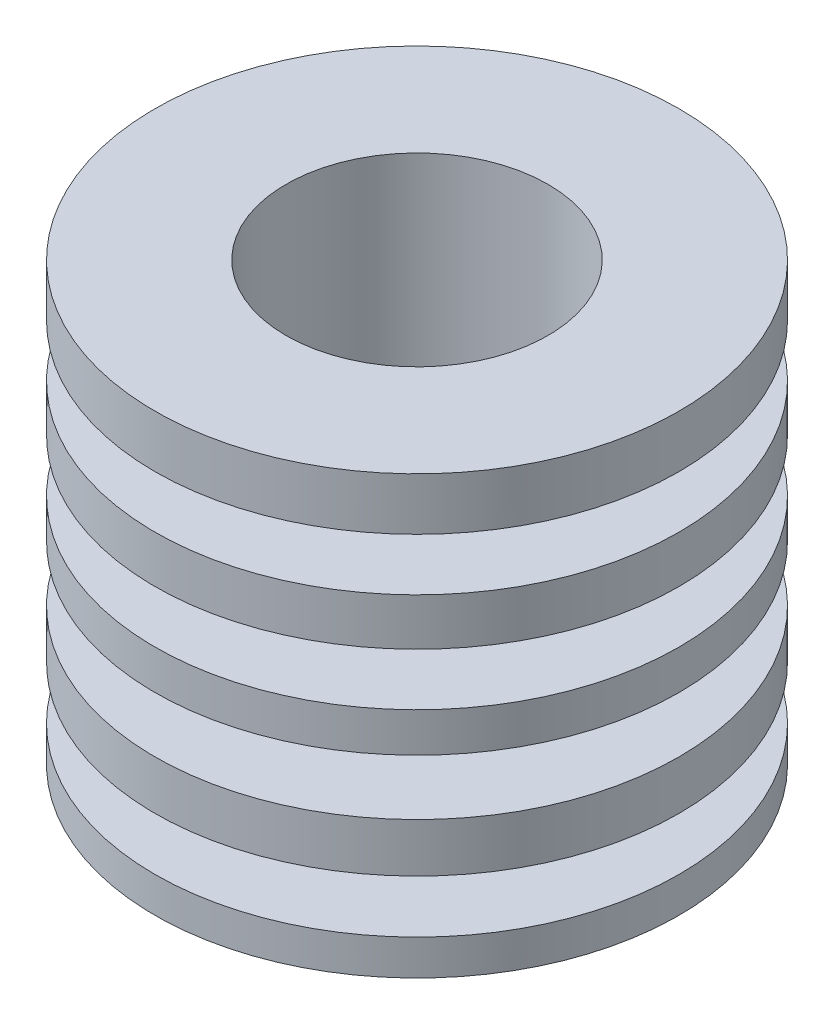
from build123d import *

# Parameters (mm, degrees)
SKETCH1_W   = 75
SKETCH1_H   = 250
SKETCH2_W   = 69.969867672
SKETCH2_H   = 30
SKETCH2_H_2 = 31.89416608
SKETCH2_H_3 = 30.244467835


with BuildPart() as part:
    # Sketch1 → Revolve1 (revolve)
    with BuildSketch(Plane.XY, mode=Mode.PRIVATE) as revolve1_sk:
        with Locations((-112.5, 125)):
            Rectangle(SKETCH1_W, SKETCH1_H)
    revolve(revolve1_sk.sketch.rotate(Axis((0, 0, 0), (0, 1, 0)), 270), axis=Axis((0, 0, 0), (0, 1, 0)))

    # Sketch2 → Cut-Revolve2 (revolve, cut)
    with BuildSketch(Plane.XY, mode=Mode.PRIVATE) as cut_revolve2_sk:
        with Locations((-115.015066164, 205)):
            Rectangle(SKETCH2_W, SKETCH2_H)
        with Locations((-115.015066164, 148.026485549)):
            Rectangle(SKETCH2_W, SKETCH2_H)
        with Locations((-115.015066164, 94.533526487)):
            Rectangle(SKETCH2_W, SKETCH2_H_2)
        with Locations((-115.015066164, 35.419339356)):
            Rectangle(SKETCH2_W, SKETCH2_H_3)
    revolve(cut_revolve2_sk.sketch.rotate(Axis((0, 0, 0), (0, 1, 0)), 180), axis=Axis((0, 0, 0), (0, 1, 0)), mode=Mode.SUBTRACT)


solid = part.part
